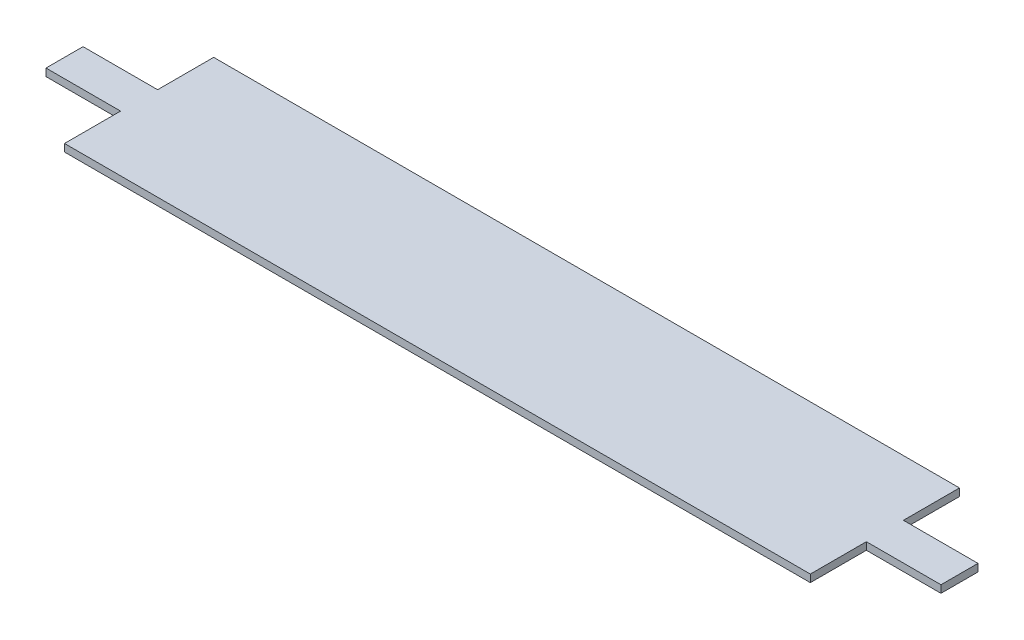
from build123d import *

# Parameters (mm, degrees)
BOSS_EXTRUDE1_DEPTH = 0.5


with BuildPart() as part:
    # Sketch1 → Boss-Extrude1 (new body)
    with BuildSketch(Plane(origin=(0, 0, 0), x_dir=(1, 0, 0), z_dir=(0, 1, 0))):
        Polygon((-25, 1.241200893), (-25, 5), (25, 5), (25, 1.241200893), (30, 1.241200893), (30, -1.241200893), (25, -1.241200893), (25, -5), (-25, -5), (-25, -1.241200893), (-30, -1.241200893), (-30, 1.241200893), align=None)
    extrude(amount=BOSS_EXTRUDE1_DEPTH)


solid = part.part
